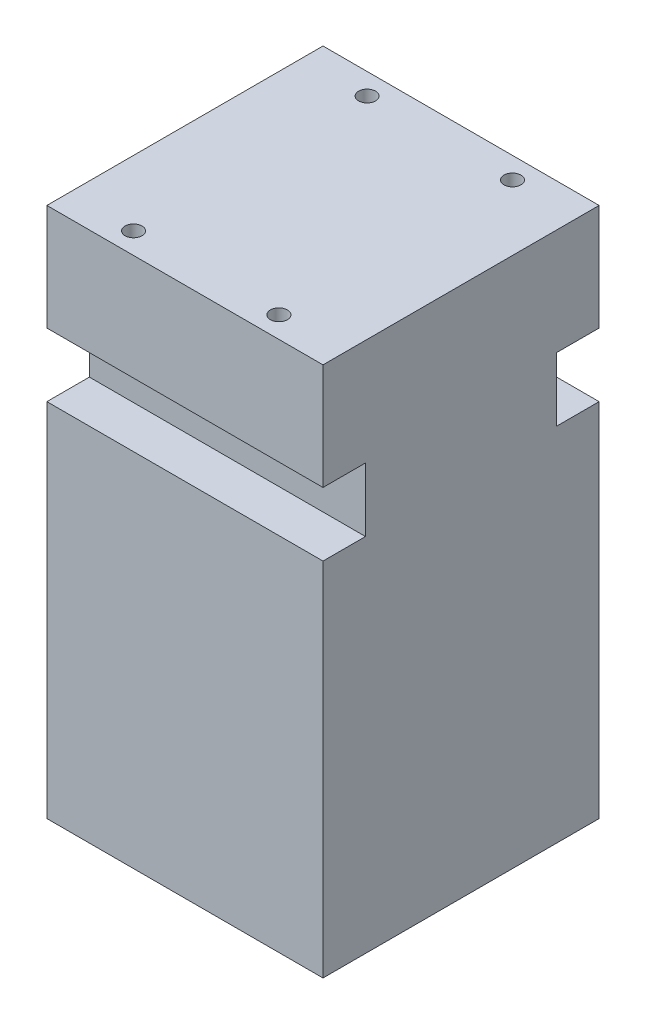
from build123d import *

# Parameters (mm, degrees)
SKETCH2_W            = 260
SKETCH2_H            = 260
BOSS_EXTRUDE1_DEPTH  = 500
SKETCH4_W            = 40
SKETCH4_H            = 60
CUT_EXTRUDE1_DEPTH   = 621.644825967
CUT_EXTRUDE2_REACH   = 622.645
MIRROR2_COPY_1_REACH = 622.645


with BuildPart() as part:
    # Sketch2 → Boss-Extrude1 (new body)
    with BuildSketch(Plane(origin=(0, 0, 0), x_dir=(1, 0, 0), z_dir=(0, 1, 0))):
        with Locations((130, 130)):
            Rectangle(SKETCH2_W, SKETCH2_H)
    extrude(amount=BOSS_EXTRUDE1_DEPTH)

    # Sketch4 → Cut-Extrude1 (cut, symmetric)
    with BuildSketch(Plane(origin=(260, 0, 0), x_dir=(0, 0, -1), z_dir=(1, 0, 0))):
        with Locations((20, 370)):
            Rectangle(SKETCH4_W, SKETCH4_H)
    cut_extrude1 = extrude(amount=CUT_EXTRUDE1_DEPTH, both=True, mode=Mode.SUBTRACT)

    # Sketch5 → Cut-Extrude2 (cut, up to next)
    with BuildSketch(Plane(origin=(0, 500, 0), x_dir=(1, 0, 0), z_dir=(0, 1, 0)), mode=Mode.PRIVATE) as cut_extrude2_sk1:
        with BuildLine():
            ThreePointArc((69.556138468, 20.047965883), (67.212992718, 25.704820132), (61.556138468, 28.047965883))
            Line((61.556138468, 28.047965883), (61.556138468, 20.047965883))
            Line((61.556138468, 20.047965883), (61.556138468, 12.047965883))
            ThreePointArc((61.556138468, 12.047965883), (67.212992718, 14.391111633), (69.556138468, 20.047965883))
        make_face()
    cut_extrude2_tool1 = extrude(cut_extrude2_sk1.sketch, amount=-CUT_EXTRUDE2_REACH, mode=Mode.PRIVATE) & part.part
    # Sketch5 → Cut-Extrude2 (cut, up to next)
    with BuildSketch(Plane(origin=(0, 500, 0), x_dir=(1, 0, 0), z_dir=(0, 1, 0)), mode=Mode.PRIVATE) as cut_extrude2_sk2:
        with BuildLine():
            Line((61.556138468, 20.047965883), (61.556138468, 28.047965883))
            ThreePointArc((61.556138468, 28.047965883), (53.556138468, 20.047965883), (61.556138468, 12.047965883))
            Line((61.556138468, 12.047965883), (61.556138468, 20.047965883))
        make_face()
    cut_extrude2_tool2 = extrude(cut_extrude2_sk2.sketch, amount=-CUT_EXTRUDE2_REACH, mode=Mode.PRIVATE) & part.part
    # Sketch5 → Cut-Extrude2 (cut, up to next)
    with BuildSketch(Plane(origin=(0, 500, 0), x_dir=(1, 0, 0), z_dir=(0, 1, 0)), mode=Mode.PRIVATE) as cut_extrude2_sk3:
        with BuildLine():
            ThreePointArc((69.556138468, 20.047965883), (67.212992718, 25.704820132), (61.556138468, 28.047965883))
            Line((61.556138468, 28.047965883), (61.556138468, 20.047965883))
            Line((61.556138468, 20.047965883), (61.556138468, 12.047965883))
            ThreePointArc((61.556138468, 12.047965883), (67.212992718, 14.391111633), (69.556138468, 20.047965883))
        make_face()
    cut_extrude2_tool3 = extrude(cut_extrude2_sk3.sketch, amount=-CUT_EXTRUDE2_REACH, mode=Mode.PRIVATE) & part.part
    # Sketch5 → Cut-Extrude2 (cut, up to next)
    with BuildSketch(Plane(origin=(0, 500, 0), x_dir=(1, 0, 0), z_dir=(0, 1, 0)), mode=Mode.PRIVATE) as cut_extrude2_sk4:
        with BuildLine():
            Line((61.556138468, 20.047965883), (61.556138468, 28.047965883))
            ThreePointArc((61.556138468, 28.047965883), (53.556138468, 20.047965883), (61.556138468, 12.047965883))
            Line((61.556138468, 12.047965883), (61.556138468, 20.047965883))
        make_face()
    cut_extrude2_tool4 = extrude(cut_extrude2_sk4.sketch, amount=-CUT_EXTRUDE2_REACH, mode=Mode.PRIVATE) & part.part
    cut_extrude2_1 = cut_extrude2_tool1.solids().sort_by_distance((64.951444, 500, -20.047966))[0]
    add(cut_extrude2_1, mode=Mode.SUBTRACT)
    cut_extrude2_2 = cut_extrude2_tool2.solids().sort_by_distance((58.160833, 500, -20.047966))[0]
    add(cut_extrude2_2, mode=Mode.SUBTRACT)
    cut_extrude2_3 = cut_extrude2_tool3.solids().sort_by_distance((64.951444, 500, -20.047966))[0]
    add(cut_extrude2_3, mode=Mode.SUBTRACT)
    cut_extrude2_4 = cut_extrude2_tool4.solids().sort_by_distance((58.160833, 500, -20.047966))[0]
    add(cut_extrude2_4, mode=Mode.SUBTRACT)
    cut_extrude2 = cut_extrude2_1 + cut_extrude2_2 + cut_extrude2_3 + cut_extrude2_4  # Cut-Extrude2 as one shape, for the pattern or mirror that repeats it

    # Mirror1: Cut-Extrude2 across plane
    add(cut_extrude2.mirror(Plane.ZY.offset(-130)), mode=Mode.SUBTRACT)

    # Mirror2: Cut-Extrude1, Cut-Extrude2 across plane
    add(cut_extrude1.mirror(Plane(origin=(0, 0, -130), x_dir=(1, 0, 0), z_dir=(0, 0, -1))), mode=Mode.SUBTRACT)
    add(cut_extrude2.mirror(Plane(origin=(0, 0, -130), x_dir=(1, 0, 0), z_dir=(0, 0, -1))), mode=Mode.SUBTRACT)

    # Mirror2 copy 1 sketch → Mirror2 copy 1 (cut, up to next)
    with BuildSketch(Plane(origin=(260, 500, -260), x_dir=(-1, 0, 0), z_dir=(0, 1, 0)), mode=Mode.PRIVATE) as mirror2_copy_1_sk1:
        with BuildLine():
            ThreePointArc((69.556138468, 20.047965883), (67.212992718, 25.704820132), (61.556138468, 28.047965883))
            Line((61.556138468, 28.047965883), (61.556138468, 20.047965883))
            Line((61.556138468, 20.047965883), (61.556138468, 12.047965883))
            ThreePointArc((61.556138468, 12.047965883), (67.212992718, 14.391111633), (69.556138468, 20.047965883))
        make_face()
    mirror2_copy_1_tool1 = extrude(mirror2_copy_1_sk1.sketch, amount=-MIRROR2_COPY_1_REACH, mode=Mode.PRIVATE) & part.part
    # Mirror2 copy 1 sketch → Mirror2 copy 1 (cut, up to next)
    with BuildSketch(Plane(origin=(260, 500, -260), x_dir=(-1, 0, 0), z_dir=(0, 1, 0)), mode=Mode.PRIVATE) as mirror2_copy_1_sk2:
        with BuildLine():
            Line((61.556138468, 20.047965883), (61.556138468, 28.047965883))
            ThreePointArc((61.556138468, 28.047965883), (53.556138468, 20.047965883), (61.556138468, 12.047965883))
            Line((61.556138468, 12.047965883), (61.556138468, 20.047965883))
        make_face()
    mirror2_copy_1_tool2 = extrude(mirror2_copy_1_sk2.sketch, amount=-MIRROR2_COPY_1_REACH, mode=Mode.PRIVATE) & part.part
    # Mirror2 copy 1 sketch → Mirror2 copy 1 (cut, up to next)
    with BuildSketch(Plane(origin=(260, 500, -260), x_dir=(-1, 0, 0), z_dir=(0, 1, 0)), mode=Mode.PRIVATE) as mirror2_copy_1_sk3:
        with BuildLine():
            ThreePointArc((69.556138468, 20.047965883), (67.212992718, 25.704820132), (61.556138468, 28.047965883))
            Line((61.556138468, 28.047965883), (61.556138468, 20.047965883))
            Line((61.556138468, 20.047965883), (61.556138468, 12.047965883))
            ThreePointArc((61.556138468, 12.047965883), (67.212992718, 14.391111633), (69.556138468, 20.047965883))
        make_face()
    mirror2_copy_1_tool3 = extrude(mirror2_copy_1_sk3.sketch, amount=-MIRROR2_COPY_1_REACH, mode=Mode.PRIVATE) & part.part
    # Mirror2 copy 1 sketch → Mirror2 copy 1 (cut, up to next)
    with BuildSketch(Plane(origin=(260, 500, -260), x_dir=(-1, 0, 0), z_dir=(0, 1, 0)), mode=Mode.PRIVATE) as mirror2_copy_1_sk4:
        with BuildLine():
            Line((61.556138468, 20.047965883), (61.556138468, 28.047965883))
            ThreePointArc((61.556138468, 28.047965883), (53.556138468, 20.047965883), (61.556138468, 12.047965883))
            Line((61.556138468, 12.047965883), (61.556138468, 20.047965883))
        make_face()
    mirror2_copy_1_tool4 = extrude(mirror2_copy_1_sk4.sketch, amount=-MIRROR2_COPY_1_REACH, mode=Mode.PRIVATE) & part.part
    add(mirror2_copy_1_tool1.solids().sort_by_distance((195.048556, 500, -239.952034))[0], mode=Mode.SUBTRACT)
    add(mirror2_copy_1_tool2.solids().sort_by_distance((201.839167, 500, -239.952034))[0], mode=Mode.SUBTRACT)
    add(mirror2_copy_1_tool3.solids().sort_by_distance((195.048556, 500, -239.952034))[0], mode=Mode.SUBTRACT)
    add(mirror2_copy_1_tool4.solids().sort_by_distance((201.839167, 500, -239.952034))[0], mode=Mode.SUBTRACT)


solid = part.part
